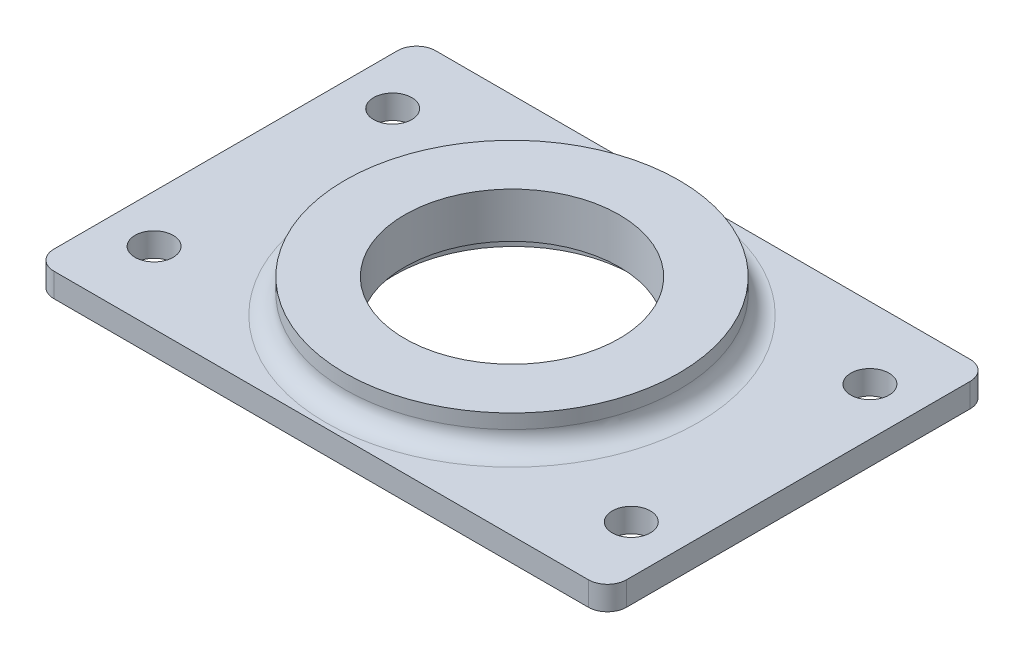
from build123d import *

# Parameters (mm, degrees)
SKETCH1_W           = 76.2
SKETCH1_H           = 50.8
SKETCH1_R           = 14.2748
BOSS_EXTRUDE1_DEPTH = 3.175
SKETCH2_R           = 22.225
BOSS_EXTRUDE2_DEPTH = 4.445
SKETCH3_R           = 14.2748
CUT_EXTRUDE1_DEPTH  = 92.688810795
SKETCH4_R           = 15.8623
CUT_EXTRUDE2_DEPTH  = 1.6002
FILLET1_R           = 2.54
FILLET2_R           = 2.54
SKETCH5_R           = 2.54
CUT_EXTRUDE3_DEPTH  = 92.688810795


with BuildPart() as part:
    # Sketch1 → Boss-Extrude1 (new body)
    with BuildSketch(Plane(origin=(0, 0, 0), x_dir=(1, 0, 0), z_dir=(0, 1, 0))):
        with Locations((38.1, 25.4)):
            Rectangle(SKETCH1_W, SKETCH1_H)
        with Locations(Location((38.1, 25.4, 0), (0, 0, 270))):
            Circle(SKETCH1_R, mode=Mode.SUBTRACT)
    extrude(amount=BOSS_EXTRUDE1_DEPTH)

    # Sketch2 → Boss-Extrude2 (add)
    with BuildSketch(Plane(origin=(0, 3.175, 0), x_dir=(1, 0, 0), z_dir=(0, 1, 0))):
        with Locations(Location((38.1, 25.4, 0), (0, 0, 90))):
            Circle(SKETCH2_R)
    extrude(amount=BOSS_EXTRUDE2_DEPTH)

    # Sketch3 → Cut-Extrude1 (cut, through all)
    with BuildSketch(Plane.XZ.offset(-3.175)):
        with Locations(Location((38.1, -25.4, 0), (0, 0, 270))):
            Circle(SKETCH3_R)
    extrude(amount=-CUT_EXTRUDE1_DEPTH, mode=Mode.SUBTRACT)

    # Sketch4 → Cut-Extrude2 (cut)
    with BuildSketch(Plane(origin=(0, 0, 0), x_dir=(-1, 0, 0), z_dir=(0, -1, 0))):
        with Locations(Location((-38.332507849, 25.4, 0), (0, 0, 90))):
            Circle(SKETCH4_R)
    extrude(amount=-CUT_EXTRUDE2_DEPTH, mode=Mode.SUBTRACT)

    # Fillet1
    fillet1_edges = [part.edges().sort_by_distance(p)[0] for p in [
        (38.1, 3.175, -3.175),
    ]]
    fillet(fillet1_edges, radius=FILLET1_R)

    # Fillet2
    fillet2_edges = [part.edges().sort_by_distance(p)[0] for p in [
        (0, 1.5875, -50.8),
        (76.2, 1.5875, -50.8),
        (76.2, 1.5875, 0),
        (0, 1.5875, 0),
    ]]
    fillet(fillet2_edges, radius=FILLET2_R)

    # Sketch5 → Cut-Extrude3 (cut, through all)
    with BuildSketch(Plane(origin=(0, 3.175, 0), x_dir=(1, 0, 0), z_dir=(0, 1, 0))):
        with Locations(Location((69.85, 41.275, 0), (0, 0, 270))):
            Circle(SKETCH5_R)
        with Locations(Location((69.85, 9.525, 0), (0, 0, 270))):
            Circle(SKETCH5_R)
        with Locations(Location((6.35, 9.525, 0), (0, 0, 270))):
            Circle(SKETCH5_R)
        with Locations(Location((6.35, 41.275, 0), (0, 0, 270))):
            Circle(SKETCH5_R)
    extrude(amount=-CUT_EXTRUDE3_DEPTH, mode=Mode.SUBTRACT)


solid = part.part
